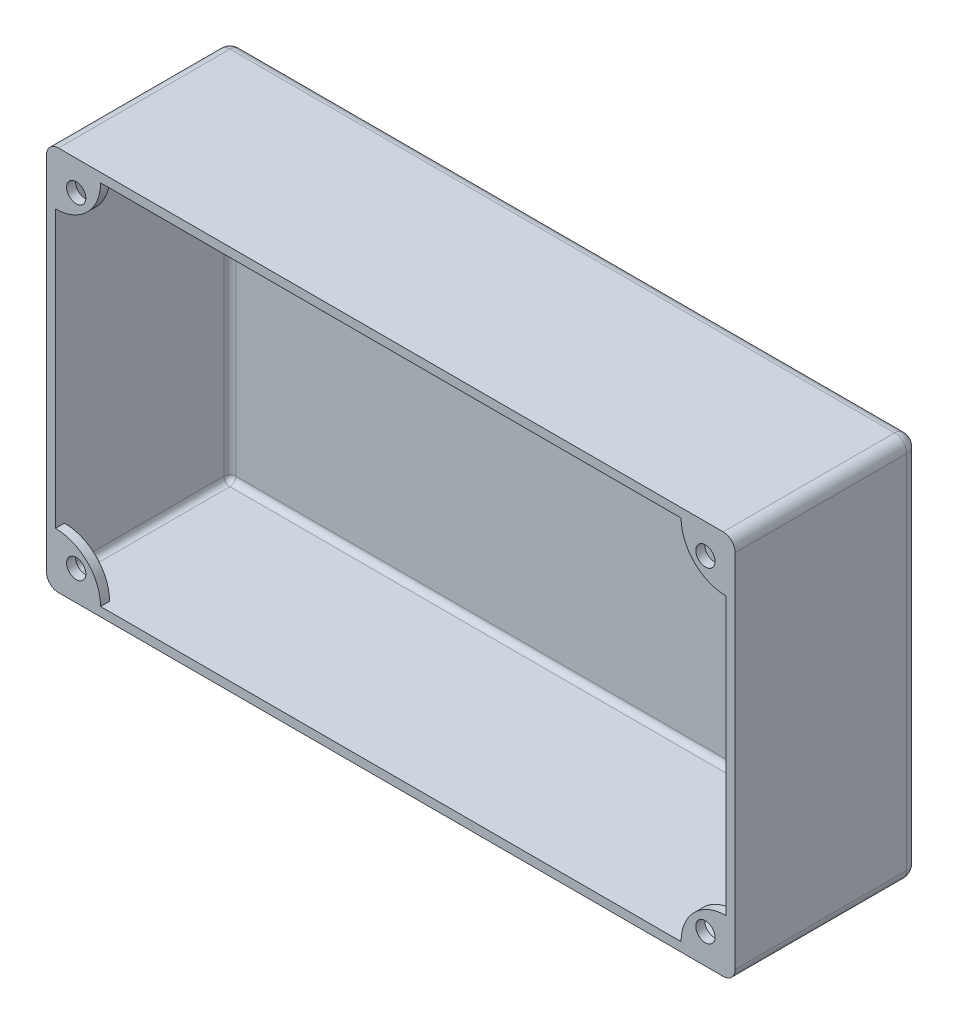
from build123d import *

# Parameters (mm, degrees)
ESQUISSE1_W             = 114.5
ESQUISSE1_H             = 64
BOSS_EXTRU_1_DEPTH      = 30.5
ENL_V_MAT_EXTRU_2_DEPTH = 1.5
ESQUISSE3_W             = 111.5
ESQUISSE3_H             = 61
ENL_V_MAT_EXTRU_3_DEPTH = 27.5
ENL_V_MAT_EXTRU_4_REACH = 96.168
ESQUISSE2_4_R           = 1.6
CONG_1_R                = 2
CONG_2_R                = 1


with BuildPart() as part:
    # Esquisse1 → Boss.-Extru.1 (new body)
    with BuildSketch(Plane.XY):
        with Locations((-21.215258856, 10.196525886)):
            Rectangle(ESQUISSE1_W, ESQUISSE1_H)
    extrude(amount=BOSS_EXTRU_1_DEPTH)

    # Esquisse2 → Enlèv. mat.-Extru.2 (cut)
    with BuildSketch(Plane.XY.offset(30.5)):
        with BuildLine():
            ThreePointArc((27.034741144, -20.303474114), (29.231440286, -15.000173256), (34.534741144, -12.803474114))
            Line((34.534741144, -12.803474114), (34.534741144, 33.196525886))
            ThreePointArc((34.534741144, 33.196525886), (29.231440286, 35.393225027), (27.034741144, 40.696525886))
            Line((27.034741144, 40.696525886), (-69.465258856, 40.696525886))
            ThreePointArc((-69.465258856, 40.696525886), (-71.661957997, 35.393225027), (-76.965258856, 33.196525886))
            Line((-76.965258856, 33.196525886), (-76.965258856, -12.803474114))
            ThreePointArc((-76.965258856, -12.803474114), (-71.661957997, -15.000173256), (-69.465258856, -20.303474114))
            Line((-69.465258856, -20.303474114), (27.034741144, -20.303474114))
        make_face()
    extrude(amount=-ENL_V_MAT_EXTRU_2_DEPTH, mode=Mode.SUBTRACT)

    # Esquisse3 → Enlèv. mat.-Extru.3 (cut)
    with BuildSketch(Plane.XY.offset(29)):
        with Locations((-21.215258856, 10.196525886)):
            Rectangle(ESQUISSE3_W, ESQUISSE3_H)
    extrude(amount=-ENL_V_MAT_EXTRU_3_DEPTH, mode=Mode.SUBTRACT)

    # Esquisse2<4> → Enlèv. mat.-Extru.4 (cut, up to next)
    with BuildSketch(Plane.XY.offset(30.5), mode=Mode.PRIVATE) as enl_v_mat_extru_4_sk1:
        with Locations((-73.515258856, 37.246525886)):
            Circle(ESQUISSE2_4_R)
    enl_v_mat_extru_4_tool1 = extrude(enl_v_mat_extru_4_sk1.sketch, amount=-ENL_V_MAT_EXTRU_4_REACH, mode=Mode.PRIVATE) & part.part
    # Esquisse2<4> → Enlèv. mat.-Extru.4 (cut, up to next)
    with BuildSketch(Plane.XY.offset(30.5), mode=Mode.PRIVATE) as enl_v_mat_extru_4_sk2:
        with Locations((31.084741144, 37.246525886)):
            Circle(ESQUISSE2_4_R)
    enl_v_mat_extru_4_tool2 = extrude(enl_v_mat_extru_4_sk2.sketch, amount=-ENL_V_MAT_EXTRU_4_REACH, mode=Mode.PRIVATE) & part.part
    # Esquisse2<4> → Enlèv. mat.-Extru.4 (cut, up to next)
    with BuildSketch(Plane.XY.offset(30.5), mode=Mode.PRIVATE) as enl_v_mat_extru_4_sk3:
        with Locations((-73.515258856, -16.853474114)):
            Circle(ESQUISSE2_4_R)
    enl_v_mat_extru_4_tool3 = extrude(enl_v_mat_extru_4_sk3.sketch, amount=-ENL_V_MAT_EXTRU_4_REACH, mode=Mode.PRIVATE) & part.part
    # Esquisse2<4> → Enlèv. mat.-Extru.4 (cut, up to next)
    with BuildSketch(Plane.XY.offset(30.5), mode=Mode.PRIVATE) as enl_v_mat_extru_4_sk4:
        with Locations((31.084741144, -16.853474114)):
            Circle(ESQUISSE2_4_R)
    enl_v_mat_extru_4_tool4 = extrude(enl_v_mat_extru_4_sk4.sketch, amount=-ENL_V_MAT_EXTRU_4_REACH, mode=Mode.PRIVATE) & part.part
    add(enl_v_mat_extru_4_tool1.solids().sort_by_distance((-73.515259, 37.246526, 30.5))[0], mode=Mode.SUBTRACT)
    add(enl_v_mat_extru_4_tool2.solids().sort_by_distance((31.084741, 37.246526, 30.5))[0], mode=Mode.SUBTRACT)
    add(enl_v_mat_extru_4_tool3.solids().sort_by_distance((-73.515259, -16.853474, 30.5))[0], mode=Mode.SUBTRACT)
    add(enl_v_mat_extru_4_tool4.solids().sort_by_distance((31.084741, -16.853474, 30.5))[0], mode=Mode.SUBTRACT)

    # Congé1
    cong_1_edges = [part.edges().sort_by_distance(p)[0] for p in [
        (-78.465258856, 10.196525886, 0),
        (-21.215258856, -21.803474114, 0),
        (-21.215258856, 42.196525886, 0),
        (36.034741144, 10.196525886, 0),
        (-78.465258856, -21.803474114, 15.25),
        (-78.465258856, 42.196525886, 15.25),
        (36.034741144, 42.196525886, 15.25),
        (36.034741144, -21.803474114, 15.25),
    ]]
    fillet(cong_1_edges, radius=CONG_1_R)

    # Congé2
    cong_2_edges = [part.edges().sort_by_distance(p)[0] for p in [
        (-21.215258856, 40.696525886, 1.5),
        (34.534741144, 10.196525886, 1.5),
        (-21.215258856, -20.303474114, 1.5),
        (-76.965258856, 10.196525886, 1.5),
        (-76.965258856, 40.696525886, 15.25),
        (34.534741144, 40.696525886, 15.25),
        (34.534741144, -20.303474114, 15.25),
        (-76.965258856, -20.303474114, 15.25),
    ]]
    fillet(cong_2_edges, radius=CONG_2_R)


solid = part.part
